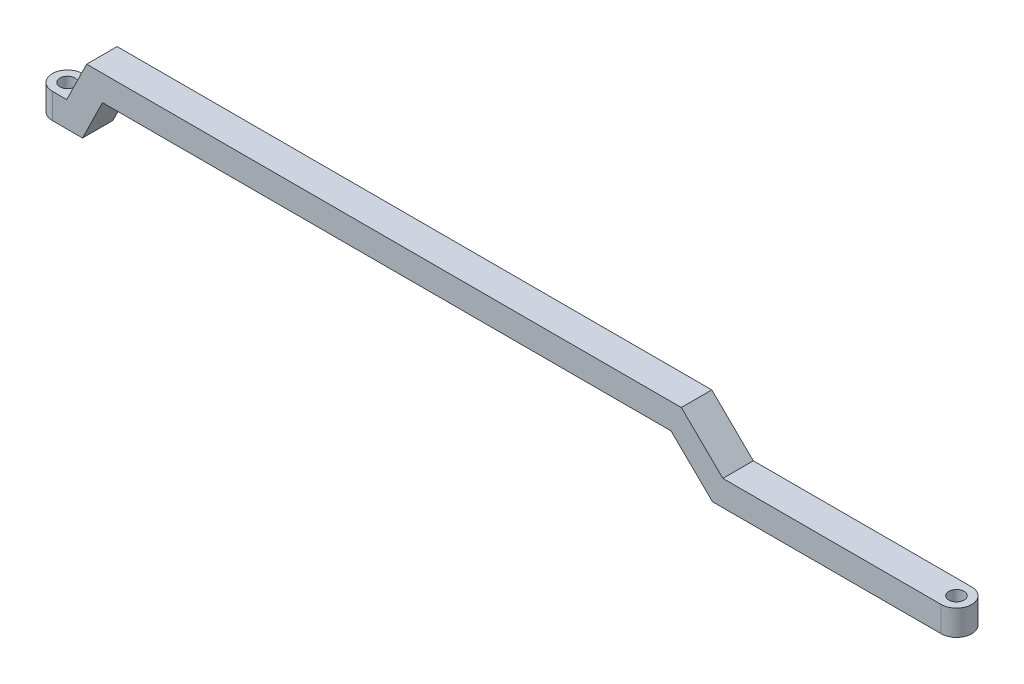
from build123d import *

# Parameters (mm, degrees)
CROQUIS1_R              = 1.5
SALIENTE_EXTRUIR1_DEPTH = 5
SALIENTE_EXTRUIR2_DEPTH = 6
CORTAR_EXTRUIR2_DEPTH   = 22


with BuildPart() as part:
    # Croquis1 → Saliente-Extruir1 (new body)
    with BuildSketch(Plane(origin=(0, 0, 0), x_dir=(1, 0, 0), z_dir=(0, 1, 0))):
        with BuildLine():
            Line((175, 3), (0, 3))
            ThreePointArc((0, 3), (-3, 0), (0, -3))
            Line((0, -3), (175, -3))
            ThreePointArc((175, -3), (178, 0), (175, 3))
        make_face()
        with Locations(Location((0, 0, 0), (0, 0, 270))):
            Circle(CROQUIS1_R, mode=Mode.SUBTRACT)
        with Locations(Location((175, 0, 0), (0, 0, 270))):
            Circle(CROQUIS1_R, mode=Mode.SUBTRACT)
    extrude(amount=SALIENTE_EXTRUIR1_DEPTH)

    # Croquis2 → Saliente-Extruir2 (add)
    with BuildSketch(Plane(origin=(0, 0, -3), x_dir=(-1, 0, 0), z_dir=(0, 0, -1))):
        Polygon((-132.006982503, 5), (-123.830535375, 13), (-6.765193463, 13), (-2.840646017, 5), (-120, 5), align=None)
    extrude(amount=-SALIENTE_EXTRUIR2_DEPTH)

    # Croquis4 → Cortar-Extruir2 (cut)
    with BuildSketch(Plane(origin=(0, 0, -3), x_dir=(-1, 0, 0), z_dir=(0, 0, -1))):
        Polygon((-9.88159135, 8), (-3.108751036, -5.80610714), (-63.338491444, -7.280350793), (-136.266049088, -6.162343586), (-121.791342394, 8), align=None)
    extrude(amount=-CORTAR_EXTRUIR2_DEPTH, mode=Mode.SUBTRACT)


solid = part.part
